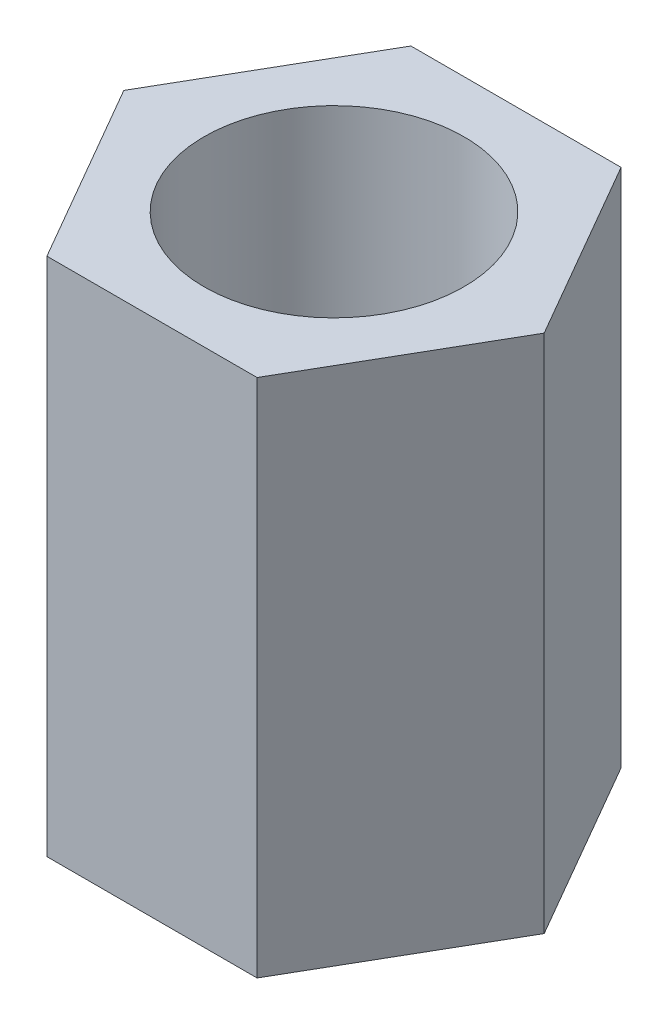
from build123d import *

# Parameters (mm, degrees)
SKETCH_1_R      = 2.5
EXTRUDE_1_DEPTH = 10


with BuildPart() as part:
    # 草图1 → 凸台-拉伸1 (new body)
    with BuildSketch(Plane(origin=(0, 0, 0), x_dir=(1, 0, 0), z_dir=(0, 1, 0))):
        Polygon((2.020725942, 3.5), (-2.020725942, 3.5), (-4.041451884, 0), (-2.020725942, -3.5), (2.020725942, -3.5), (4.041451884, 0), align=None)
        with Locations(Location((0, 0, 0), (0, 0, 270))):
            Circle(SKETCH_1_R, mode=Mode.SUBTRACT)
    extrude(amount=EXTRUDE_1_DEPTH)


solid = part.part
